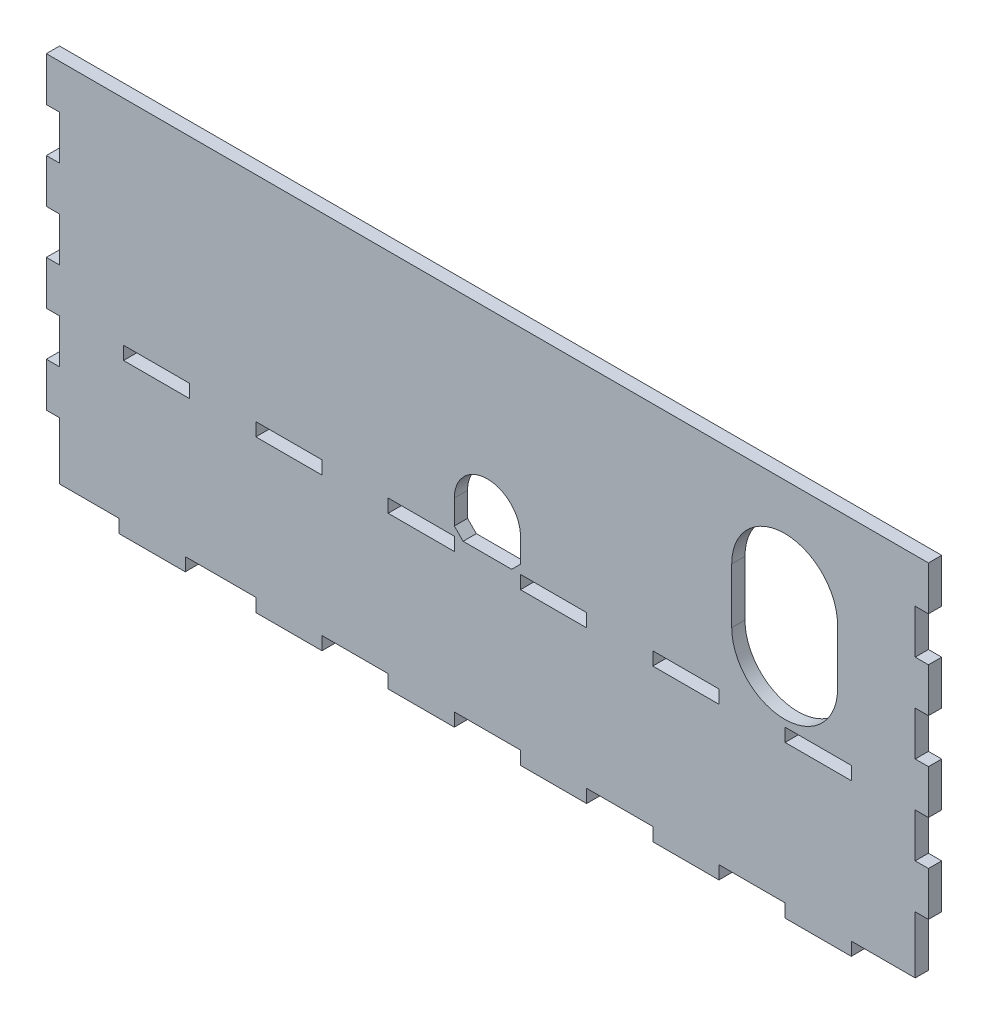
from build123d import *

# Parameters (mm, degrees)
BOSS_EXTRUDE1_DEPTH = 3
SKETCH2_W           = 15
SKETCH2_H           = 3
CUT_EXTRUDE1_DEPTH  = 10


with BuildPart() as part:
    # Sketch1 → Boss-Extrude1 (new body)
    with BuildSketch(Plane.XY):
        Polygon((-97, -12.5), (-97, -25.5), (-83.5, -25.5), (-83.5, -28.5), (-68.5, -28.5), (-68.5, -25.5), (-52.5, -25.5), (-52.5, -28.5), (-37.5, -28.5), (-37.5, -25.5), (-22.5, -25.5), (-22.5, -28.5), (-7.5, -28.5), (-7.5, -25.5), (0, -25.5), (7.5, -25.5), (7.5, -28.5), (22.5, -28.5), (22.5, -25.5), (30, -25.5), (37.5, -25.5), (37.5, -28.5), (52.5, -28.5), (52.5, -25.5), (60, -25.5), (67.5, -25.5), (67.5, -28.5), (82.5, -28.5), (82.5, -25.5), (97, -25.5), (97, -12.5), (100, -12.5), (100, -2.5), (97, -2.5), (97, 7.5), (100, 7.5), (100, 17.5), (97, 17.5), (97, 27.5), (100, 27.5), (100, 37.5), (97, 37.5), (97, 47.5), (100, 47.5), (100, 57.5), (97, 57.5), (-97, 57.5), (-100, 57.5), (-100, 47.5), (-97, 47.5), (-97, 37.5), (-100, 37.5), (-100, 27.5), (-97, 27.5), (-97, 17.5), (-100, 17.5), (-100, 7.5), (-97, 7.5), (-97, -2.5), (-100, -2.5), (-100, -12.5), align=None)
    extrude(amount=BOSS_EXTRUDE1_DEPTH)

    # Sketch2 → Cut-Extrude1 (cut)
    with BuildSketch(Plane.XY.offset(3)):
        with BuildLine():
            Line((55.4, 22.5), (55.4, 35))
            ThreePointArc((55.4, 35), (67.4, 47), (79.4, 35))
            Line((79.4, 35), (79.4, 22.5))
            ThreePointArc((79.4, 22.5), (67.4, 10.5), (55.4, 22.5))
        make_face()
        with Locations((15, 7.5)):
            Rectangle(SKETCH2_W, SKETCH2_H)
        with Locations((45, 7.5)):
            Rectangle(SKETCH2_W, SKETCH2_H)
        with Locations((75, 7.5)):
            Rectangle(SKETCH2_W, SKETCH2_H)
        with Locations((-75, 7.5)):
            Rectangle(SKETCH2_W, SKETCH2_H)
        with Locations((-45, 7.5)):
            Rectangle(SKETCH2_W, SKETCH2_H)
        with Locations((-15, 7.5)):
            Rectangle(SKETCH2_W, SKETCH2_H)
        with BuildLine():
            Line((-7.5, 11), (-7.5, 16.5))
            ThreePointArc((-7.5, 16.5), (0, 24), (7.5, 16.5))
            Line((7.5, 16.5), (7.5, 11))
            Line((7.5, 11), (5.5, 9))
            Line((5.5, 9), (-5.5, 9))
            Line((-5.5, 9), (-7.5, 11))
        make_face()
    extrude(amount=-CUT_EXTRUDE1_DEPTH, mode=Mode.SUBTRACT)


solid = part.part
